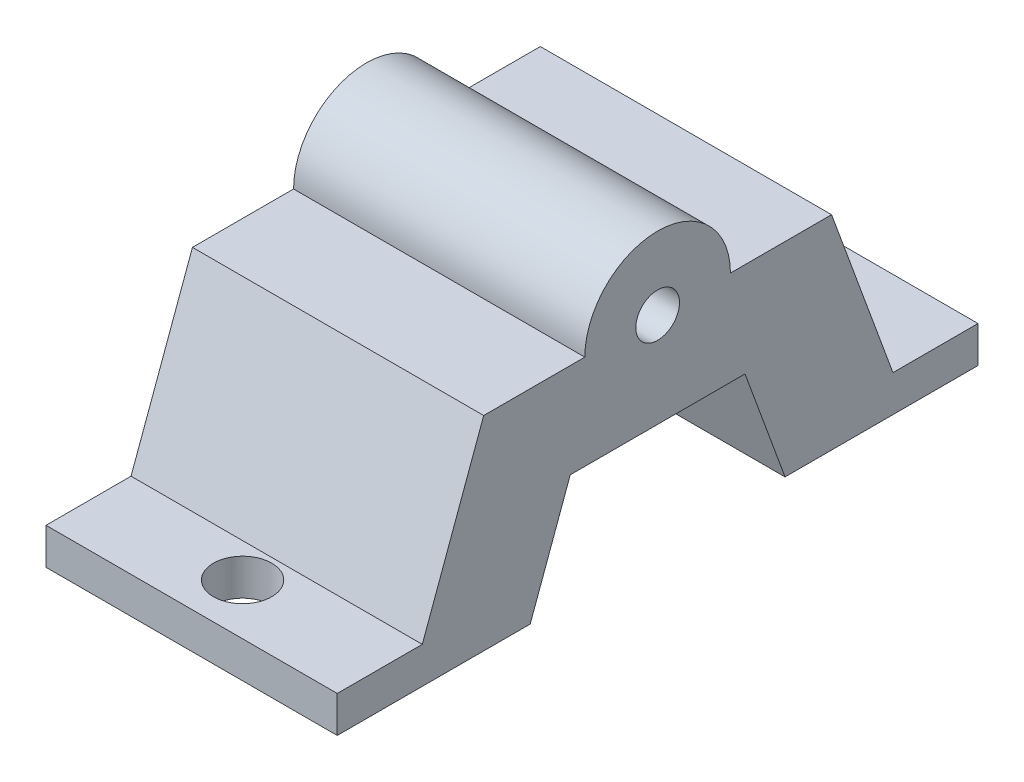
from build123d import *

# Parameters (mm, degrees)
SKETCH1_R           = 3
BOSS_EXTRUDE1_DEPTH = 40
SKETCH2_R           = 4
CUT_EXTRUDE1_DEPTH  = 40


with BuildPart() as part:
    # Sketch1 → Boss-Extrude1 (new body)
    with BuildSketch(Plane(origin=(0, 0, 0), x_dir=(0, 0, -1), z_dir=(1, 0, 0))):
        with BuildLine():
            Line((-24.097227121, 0), (-24.097227121, 5))
            Line((-24.097227121, 5), (-12.418356006, 5))
            Line((-12.418356006, 5), (-3.985022672, 28))
            Line((-3.985022672, 28), (9.902772879, 28))
            ThreePointArc((9.902772879, 28), (19.902772879, 38), (29.902772879, 28))
            Line((29.902772879, 28), (43.79056843, 28))
            Line((43.79056843, 28), (52.223901764, 5))
            Line((52.223901764, 5), (63.902772879, 5))
            Line((63.902772879, 5), (63.902772879, 0))
            Line((63.902772879, 0), (37.402772879, 0))
            Line((37.402772879, 0), (31.902772879, 15))
            Line((31.902772879, 15), (7.902772879, 15))
            Line((7.902772879, 15), (2.402772879, 0))
            Line((2.402772879, 0), (-24.097227121, 0))
        make_face()
        with Locations((19.902772879, 28)):
            Circle(SKETCH1_R, mode=Mode.SUBTRACT)
    extrude(amount=-BOSS_EXTRUDE1_DEPTH)

    # Sketch2 → Cut-Extrude1 (cut)
    with BuildSketch(Plane(origin=(0, 5, 0), x_dir=(1, 0, 0), z_dir=(0, 1, 0))):
        with Locations(Location((-20, -17.097227121, 0), (0, 0, 270))):
            Circle(SKETCH2_R)
        with Locations(Location((-20, 56.902772879, 0), (0, 0, 270))):
            Circle(SKETCH2_R)
    extrude(amount=-CUT_EXTRUDE1_DEPTH, mode=Mode.SUBTRACT)


solid = part.part
